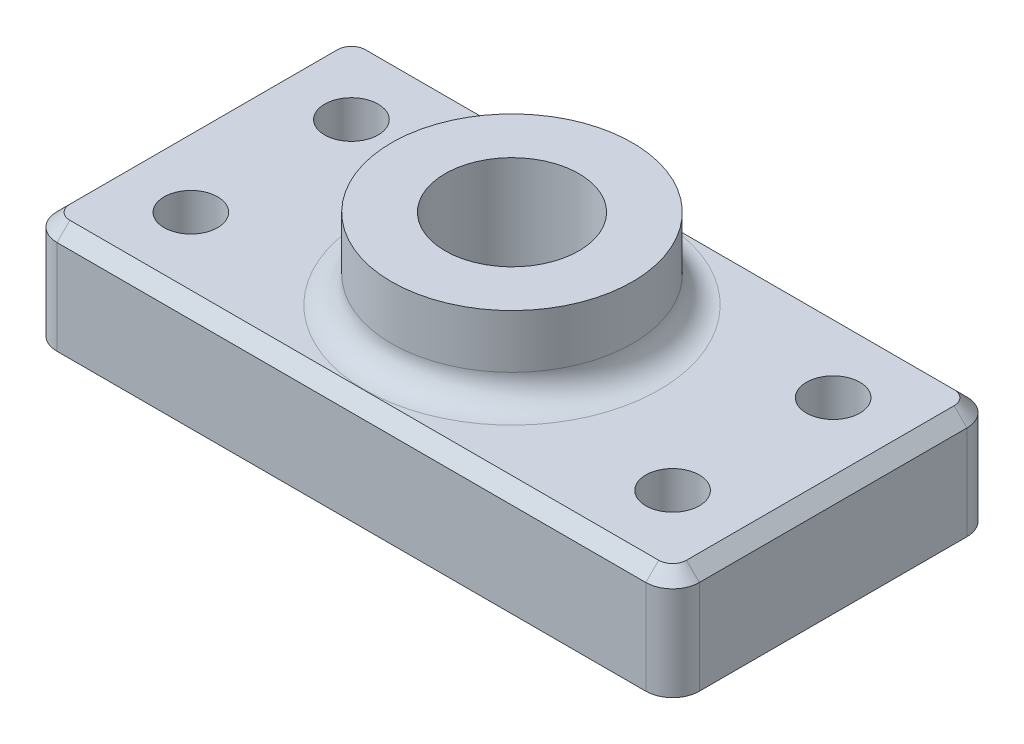
from build123d import *

# Parameters (mm, degrees)
SKETCH1_W           = 6000
SKETCH1_H           = 3000
SKETCH1_R           = 250
BOSS_EXTRUDE1_DEPTH = 1000
SKETCH2_R           = 1125
SKETCH2_R_2         = 625
BOSS_EXTRUDE2_DEPTH = 750
SKETCH4_R           = 625
CUT_EXTRUDE1_DEPTH  = 3501
FILLET1_R           = 250
FILLET2_R           = 250
CHAMFER1_SIZE       = 120


with BuildPart() as part:
    # Sketch1 → Boss-Extrude1 (new body)
    with BuildSketch(Plane(origin=(0, 0, 0), x_dir=(1, 0, 0), z_dir=(0, 1, 0))):
        Rectangle(SKETCH1_W, SKETCH1_H)
        with Locations(Location((-2250, 750, 0), (0, 0, 270))):
            Circle(SKETCH1_R, mode=Mode.SUBTRACT)
        with Locations(Location((2250, 750, 0), (0, 0, 90))):
            Circle(SKETCH1_R, mode=Mode.SUBTRACT)
        with Locations(Location((-2250, -750, 0), (0, 0, 90))):
            Circle(SKETCH1_R, mode=Mode.SUBTRACT)
        with Locations(Location((2250, -750, 0), (0, 0, 270))):
            Circle(SKETCH1_R, mode=Mode.SUBTRACT)
    extrude(amount=BOSS_EXTRUDE1_DEPTH)

    # Sketch2 → Boss-Extrude2 (add)
    with BuildSketch(Plane(origin=(0, 1000, 0), x_dir=(1, 0, 0), z_dir=(0, 1, 0))):
        with Locations(Location((0, 0, 0), (0, 0, 270))):
            Circle(SKETCH2_R)
        with Locations(Location((0, 0, 0), (0, 0, 270))):
            Circle(SKETCH2_R_2, mode=Mode.SUBTRACT)
    extrude(amount=BOSS_EXTRUDE2_DEPTH)

    # Sketch4 → Cut-Extrude1 (cut, through all)
    with BuildSketch(Plane(origin=(0, 1000, 0), x_dir=(1, 0, 0), z_dir=(0, 1, 0))):
        with Locations(Location((0, 0, 0), (0, 0, 270))):
            Circle(SKETCH4_R)
    extrude(amount=-CUT_EXTRUDE1_DEPTH, mode=Mode.SUBTRACT)

    # Fillet1
    fillet1_edges = [part.edges().sort_by_distance(p)[0] for p in [
        (0, 1000, -1125),
    ]]
    fillet(fillet1_edges, radius=FILLET1_R)

    # Fillet2
    fillet2_edges = [part.edges().sort_by_distance(p)[0] for p in [
        (-3000, 500, -1500),
        (3000, 500, -1500),
        (3000, 500, 1500),
        (-3000, 500, 1500),
    ]]
    fillet(fillet2_edges, radius=FILLET2_R)

    # Chamfer1
    chamfer1_edges = [part.edges().sort_by_distance(p)[0] for p in [
        (-3000, 1000, 0),
        (0, 1000, -1500),
        (0, 1000, 1500),
        (3000, 1000, 0),
        (-2926.776695297, 1000, 1426.776695297),
        (2926.776695297, 1000, 1426.776695297),
        (2926.776695297, 1000, -1426.776695297),
        (-2926.776695297, 1000, -1426.776695297),
    ]]
    chamfer(chamfer1_edges, length=CHAMFER1_SIZE)


solid = part.part
